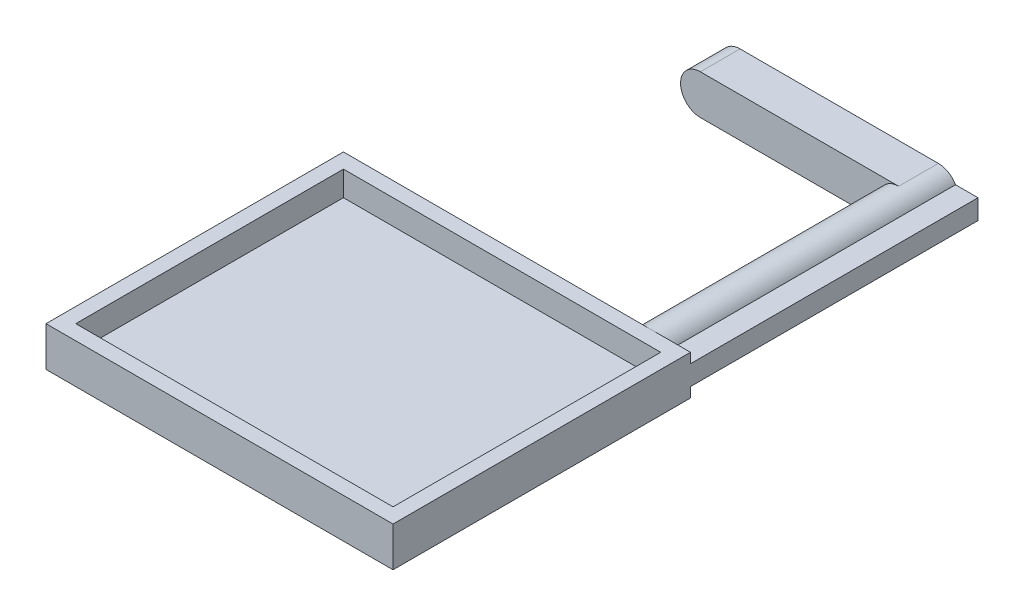
from build123d import *
from build123d.topology import SkipClean

# Parameters (mm, degrees)
EXTRUDE_1_DEPTH      = 5
EXTRUDE_1_DEPTH_BACK = 50
SKETCH_2_R           = 2.1
CUT_EXTRUDE_1_DEPTH  = 56.722526863
SKETCH_13_R          = 8.470611641
CUT_EXTRUDE_6_DEPTH  = 5
EXTRUDE_START        = 8
EXTRUDE_4_DEPTH      = 8
SKETCH_18_R          = 3.1
CUT_EXTRUDE_7_DEPTH  = 3.05
EXTRUDE_5_DEPTH      = 8
SKETCH_21_W          = 70
SKETCH_21_H          = 8
EXTRUDE_6_DEPTH      = 60
SKETCH_22_W          = 64
SKETCH_22_H          = 54
CUT_EXTRUDE_8_DEPTH  = 5


with BuildPart() as part:
    # ｽｹｯﾁ1 → ﾎﾞｽ - 押し出し1 (new, two sides: drawn at the far end of the back side and taken through both)
    with BuildSketch(Plane.XY.offset(-EXTRUDE_1_DEPTH_BACK)):
        with BuildLine():
            Line((3.464101615, 2), (8, 2))
            Line((8, 2), (8, -2))
            Line((8, -2), (3.464101615, -2))
            ThreePointArc((3.464101615, -2), (-4, 0), (3.464101615, 2))
        make_face()
    extrude(amount=EXTRUDE_1_DEPTH + EXTRUDE_1_DEPTH_BACK)

    # ｽｹｯﾁ2 → ｶｯﾄ - 押し出し1 (cut, through all)
    with BuildSketch(Plane(origin=(0, 0, -50), x_dir=(-1, 0, 0), z_dir=(0, 0, -1))):
        Circle(SKETCH_2_R)
    extrude(amount=-CUT_EXTRUDE_1_DEPTH, mode=Mode.SUBTRACT)

    # ｽｹｯﾁ13 → ｶｯﾄ - 押し出し6 (cut)
    with BuildSketch(Plane.XY.offset(5)):
        Circle(SKETCH_13_R)
    extrude(amount=-CUT_EXTRUDE_6_DEPTH, mode=Mode.SUBTRACT)

    # ｽｹｯﾁ15 → ﾎﾞｽ - 押し出し4 (add)
    with SkipClean():  # the faces are left unmerged after this step: merging them gives an invalid solid
        with BuildSketch(Plane(origin=(0, 0, -50), x_dir=(-1, 0, 0), z_dir=(0, 0, -1)).offset(EXTRUDE_START)):
            with BuildLine():
                Line((40, -4), (0, -4))
                ThreePointArc((0, -4), (-4, 0), (0, 4))
                Line((0, 4), (40, 4))
                ThreePointArc((40, 4), (44, 0), (40, -4))
            make_face()
        extrude(amount=-EXTRUDE_4_DEPTH)

    # ｽｹｯﾁ18 → ｶｯﾄ - 押し出し7 (cut)
    with SkipClean():  # the faces are left unmerged after this step: merging them gives an invalid solid
        with BuildSketch(Plane(origin=(0, 0, -58), x_dir=(-1, 0, 0), z_dir=(0, 0, -1))):
            Circle(SKETCH_18_R)
            with Locations((40, 0)):
                Circle(SKETCH_18_R)
            with Locations((20, 0)):
                Circle(SKETCH_18_R)
            with Locations((10, 0)):
                Circle(SKETCH_18_R)
            with Locations((30, 0)):
                Circle(SKETCH_18_R)
        extrude(amount=-CUT_EXTRUDE_7_DEPTH, mode=Mode.SUBTRACT)

    # ｽｹｯﾁ20 → ﾎﾞｽ - 押し出し5 (add)
    with BuildSketch(Plane(origin=(0, 0, -50), x_dir=(-1, 0, 0), z_dir=(0, 0, -1)).offset(EXTRUDE_START)):
        with BuildLine():
            Line((-3.464101615, 2), (-8, 2))
            Line((-8, 2), (-8, -2))
            Line((-8, -2), (-3.464101615, -2))
            ThreePointArc((-3.464101615, -2), (-4, 0), (-3.464101615, 2))
        make_face()
    extrude(amount=-EXTRUDE_5_DEPTH)

    # ｽｹｯﾁ21 → ﾎﾞｽ - 押し出し6 (add)
    with BuildSketch(Plane.XY):
        with Locations((-27, 0)):
            Rectangle(SKETCH_21_W, SKETCH_21_H)
    extrude(amount=EXTRUDE_6_DEPTH)

    # ｽｹｯﾁ22 → ｶｯﾄ - 押し出し8 (cut)
    with BuildSketch(Plane(origin=(0, 4, 0), x_dir=(1, 0, 0), z_dir=(0, 1, 0))):
        with Locations((-27, -30)):
            Rectangle(SKETCH_22_W, SKETCH_22_H)
    extrude(amount=-CUT_EXTRUDE_8_DEPTH, mode=Mode.SUBTRACT)


solid = part.part
